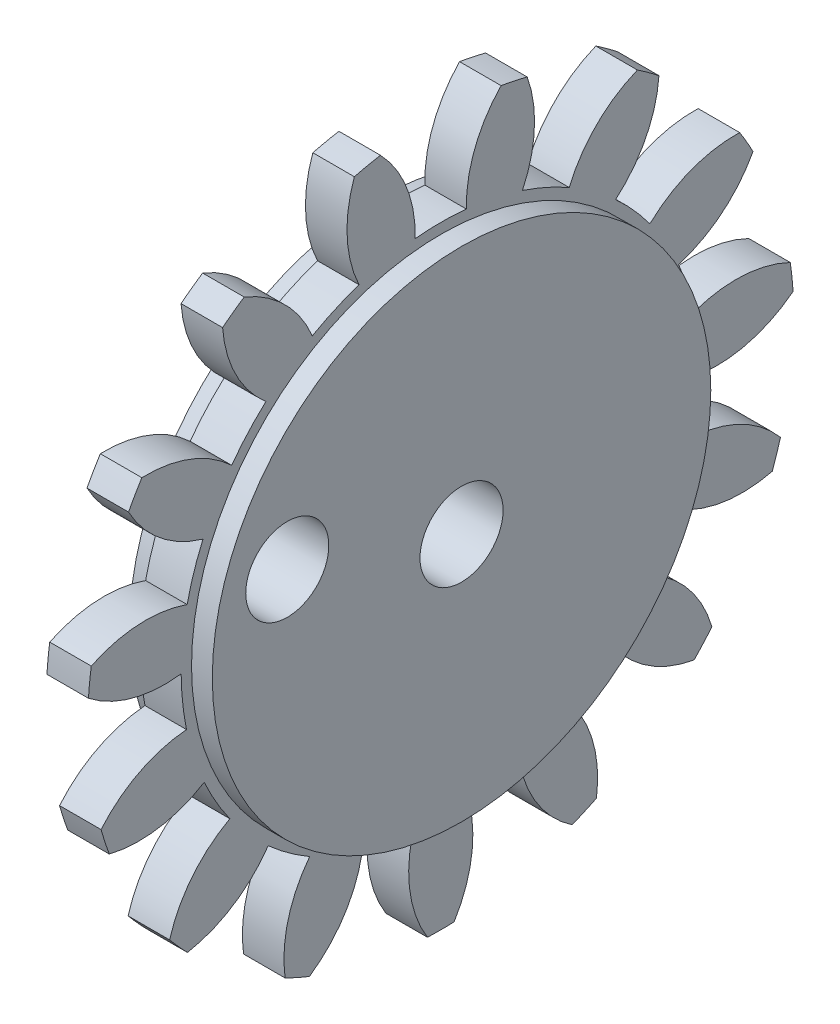
from build123d import *

# Parameters (mm, degrees)
BASPROSKE_W        = 6.35
BASPROSKE_H        = 53.975
TOOTHCUT_DEPTH     = 77.59584682
TEETHCUTS_COUNT    = 15
TEETHCUTS_ANGLE    = 336
HUBNEABOTSKE_R     = 38.1
HUBNEARBOTH_DEPTH  = 3.1750254
HUBFAR_START       = 3.1750254
HUBFARSKE_R        = 38.1
HUBFAR_DEPTH       = 3.1750254
BORSKE_R           = 6.35
BORE_DEPTH         = 12.7000508
SKETCH1_R          = 6.35
CUT_EXTRUDE1_DEPTH = 78.297193623
SCALE1_SCALE       = 0.75


with BuildPart() as part:
    # BasProSke → Base-Revolve (revolve)
    with BuildSketch(Plane(origin=(0, 0, 0), x_dir=(1, 0, 0), z_dir=(0, 1, 0)), mode=Mode.PRIVATE) as base_revolve_sk:
        with Locations((3.175, 26.9875)):
            Rectangle(BASPROSKE_W, BASPROSKE_H)
    revolve(base_revolve_sk.sketch.rotate(Axis((-10, 0, 0), (1, 0, 0)), 180), axis=Axis((-10, 0, 0), (1, 0, 0)))

    # TooCutSke → ToothCut (cut, through all)
    with BuildSketch(Plane(origin=(0, 0, 0), x_dir=(0, 0, -1), z_dir=(1, 0, 0))):
        with BuildLine():
            ThreePointArc((3.91547882, 39.492605349), (0, 39.68623), (-3.91547882, 39.492605349))
            ThreePointArc((-3.91547882, 39.492605349), (-5.201686692, 46.882953453), (-9.241355572, 53.20376441))
            ThreePointArc((-9.241355572, 53.20376441), (0, 54.0004), (9.241355572, 53.20376441))
            ThreePointArc((9.241355572, 53.20376441), (5.201686692, 46.882953453), (3.91547882, 39.492605349))
        make_face()
    toothcut = extrude(amount=TOOTHCUT_DEPTH, mode=Mode.SUBTRACT)

    # TeethCuts: ToothCut ×15 about axis
    teethcuts_axis = Axis((-10, 0, 0), (1, 0, 0))
    for i in range(1, TEETHCUTS_COUNT):
        add(toothcut.rotate(teethcuts_axis, i * TEETHCUTS_ANGLE / (TEETHCUTS_COUNT - 1)), mode=Mode.SUBTRACT)

    # HubNeaBotSke → HubNearBoth (add)
    with BuildSketch(Plane.ZY):
        with Locations(Location((0, 0, 0), (0, 0, 180))):
            Circle(HUBNEABOTSKE_R)
    extrude(amount=HUBNEARBOTH_DEPTH)

    # HubFarSke → HubFar (add)
    with BuildSketch(Plane(origin=(6.35, 0, 0), x_dir=(0, 0, -1), z_dir=(1, 0, 0)).offset(HUBFAR_START)):
        Circle(HUBFARSKE_R)
    extrude(amount=-HUBFAR_DEPTH)

    # BorSke → Bore (cut, symmetric)
    with BuildSketch(Plane(origin=(0, 0, 0), x_dir=(0, 0, -1), z_dir=(1, 0, 0))):
        with Locations(Location((0, 0, 0), (0, 0, 180))):
            Circle(BORSKE_R)
    extrude(amount=BORE_DEPTH, both=True, mode=Mode.SUBTRACT)

    # Sketch1 → Cut-Extrude1 (cut, through all)
    with BuildSketch(Plane.ZY.offset(3.1750254)):
        with Locations((26.638896337, 8.655502106)):
            Circle(SKETCH1_R)
    extrude(amount=-CUT_EXTRUDE1_DEPTH, mode=Mode.SUBTRACT)


with BuildPart() as part_1:
    # Scale1: scaled about (3.175, -0.202804759, -0.624168867)
    add(part.part.scale(SCALE1_SCALE).moved(Location((0.79375, -0.05070119, -0.156042217))))


solid = part_1.part
